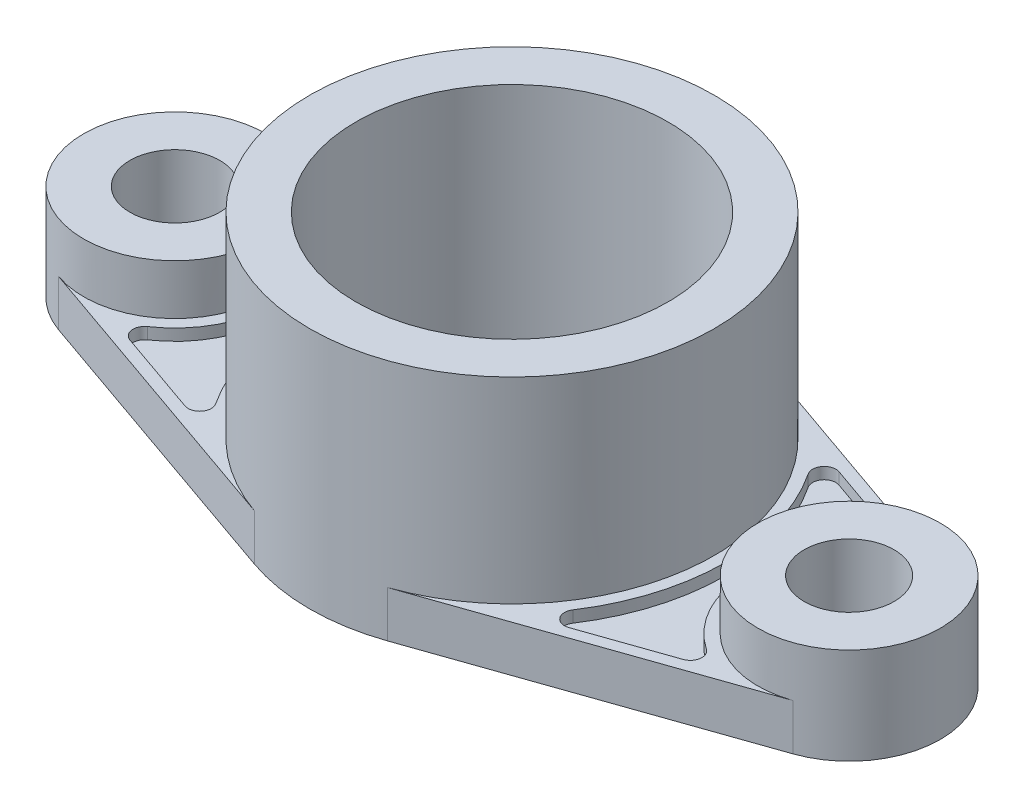
from build123d import *

# Parameters (mm, degrees)
SKETCH1_R           = 23.666666667
SKETCH1_R_2         = 11.666666667
BOSS_EXTRUDE1_DEPTH = 9
SKETCH1_5_R         = 23.666666667
SKETCH1_5_R_2       = 11.666666667
BOSS_EXTRUDE2_DEPTH = 25
BOSS_EXTRUDE3_DEPTH = 63
BOSS_EXTRUDE4_DEPTH = 3


with BuildPart() as part:
    # Sketch1 → Boss-Extrude1 (new body)
    # profile 1 of 8: a face of its own
    with BuildSketch(Plane(origin=(0, 0, 0), x_dir=(1, 0, 0), z_dir=(0, 1, 0))):
        with Locations((-87.5, 0)):
            Circle(SKETCH1_R)
        with Locations(Location((-87.5, 0, 0), (0, 0, 270))):
            Circle(SKETCH1_R_2, mode=Mode.SUBTRACT)
    # profile 2 of 8: a face of its own
    with BuildSketch(Plane(origin=(0, 0, 0), x_dir=(1, 0, 0), z_dir=(0, 1, 0))):
        with BuildLine():
            ThreePointArc((-17.3, -49.567731439), (-52.5, 0), (-17.3, 49.567731439))
            Line((-17.3, 49.567731439), (-95.298730159, 22.344818617))
            ThreePointArc((-95.298730159, 22.344818617), (-73.797059366, 19.296127308), (-63.833333333, 0))
            ThreePointArc((-63.833333333, 0), (-73.797059366, -19.296127308), (-95.298730159, -22.344818617))
            Line((-95.298730159, -22.344818617), (-17.3, -49.567731439))
        make_face()
    # profile 3 of 8: a face of its own
    with BuildSketch(Plane(origin=(0, 0, 0), x_dir=(1, 0, 0), z_dir=(0, 1, 0))):
        with BuildLine():
            ThreePointArc((52.5, 0), (42.804789452, 30.397368307), (17.3, 49.567731439))
            ThreePointArc((17.3, 49.567731439), (8.773371628, 51.761742149), (0, 52.5))
            Line((0, 52.5), (0, 40.5))
            ThreePointArc((0, 40.5), (28.637824638, 28.637824638), (40.5, 0))
            ThreePointArc((40.5, 0), (28.637824638, -28.637824638), (0, -40.5))
            Line((0, -40.5), (0, -52.5))
            ThreePointArc((0, -52.5), (8.773371628, -51.761742149), (17.3, -49.567731439))
            ThreePointArc((17.3, -49.567731439), (42.804789452, -30.397368307), (52.5, 0))
        make_face()
    # profile 4 of 8: a face of its own
    with BuildSketch(Plane(origin=(0, 0, 0), x_dir=(1, 0, 0), z_dir=(0, 1, 0))):
        with BuildLine():
            Line((0, 40.5), (0, 52.5))
            ThreePointArc((0, 52.5), (-8.773371628, 51.761742149), (-17.3, 49.567731439))
            ThreePointArc((-17.3, 49.567731439), (-52.5, 0), (-17.3, -49.567731439))
            ThreePointArc((-17.3, -49.567731439), (-8.773371628, -51.761742149), (0, -52.5))
            Line((0, -52.5), (0, -40.5))
            ThreePointArc((0, -40.5), (-40.5, 0), (0, 40.5))
        make_face()
    # profile 5 of 8: a face of its own
    with BuildSketch(Plane(origin=(0, 0, 0), x_dir=(1, 0, 0), z_dir=(0, 1, 0))):
        with BuildLine():
            ThreePointArc((52.5, 0), (42.804789452, 30.397368307), (17.3, 49.567731439))
            ThreePointArc((17.3, 49.567731439), (8.773371628, 51.761742149), (0, 52.5))
            Line((0, 52.5), (0, 40.5))
            ThreePointArc((0, 40.5), (28.637824638, 28.637824638), (40.5, 0))
            ThreePointArc((40.5, 0), (28.637824638, -28.637824638), (0, -40.5))
            Line((0, -40.5), (0, -52.5))
            ThreePointArc((0, -52.5), (8.773371628, -51.761742149), (17.3, -49.567731439))
            ThreePointArc((17.3, -49.567731439), (42.804789452, -30.397368307), (52.5, 0))
        make_face()
    # profile 6 of 8: a face of its own
    with BuildSketch(Plane(origin=(0, 0, 0), x_dir=(1, 0, 0), z_dir=(0, 1, 0))):
        with BuildLine():
            Line((0, 40.5), (0, 52.5))
            ThreePointArc((0, 52.5), (-8.773371628, 51.761742149), (-17.3, 49.567731439))
            ThreePointArc((-17.3, 49.567731439), (-52.5, 0), (-17.3, -49.567731439))
            ThreePointArc((-17.3, -49.567731439), (-8.773371628, -51.761742149), (0, -52.5))
            Line((0, -52.5), (0, -40.5))
            ThreePointArc((0, -40.5), (-40.5, 0), (0, 40.5))
        make_face()
    # profile 7 of 8: a face of its own
    with BuildSketch(Plane(origin=(0, 0, 0), x_dir=(1, 0, 0), z_dir=(0, 1, 0))):
        with BuildLine():
            Line((95.298730159, 22.344818617), (17.3, 49.567731439))
            ThreePointArc((17.3, 49.567731439), (42.804789452, 30.397368307), (52.5, 0))
            ThreePointArc((52.5, 0), (42.804789452, -30.397368307), (17.3, -49.567731439))
            Line((17.3, -49.567731439), (95.298730159, -22.344818617))
            ThreePointArc((95.298730159, -22.344818617), (63.833333333, 0), (95.298730159, 22.344818617))
        make_face()
    # profile 8 of 8: a face of its own
    with BuildSketch(Plane(origin=(0, 0, 0), x_dir=(1, 0, 0), z_dir=(0, 1, 0))):
        with Locations((87.5, 0)):
            Circle(SKETCH1_R)
        with Locations(Location((87.5, 0, 0), (0, 0, 270))):
            Circle(SKETCH1_R_2, mode=Mode.SUBTRACT)
    extrude(amount=BOSS_EXTRUDE1_DEPTH)

    # Sketch1<5> → Boss-Extrude2 (add)
    # profile 1 of 2: a face of its own
    with BuildSketch(Plane(origin=(0, 0, 0), x_dir=(1, 0, 0), z_dir=(0, 1, 0))):
        with Locations(Location((-87.5, 0, 0), (0, 0, 109.239875225))):
            Circle(SKETCH1_5_R)
        with Locations(Location((-87.5, 0, 0), (0, 0, 270))):
            Circle(SKETCH1_5_R_2, mode=Mode.SUBTRACT)
    # profile 2 of 2: a face of its own
    with BuildSketch(Plane(origin=(0, 0, 0), x_dir=(1, 0, 0), z_dir=(0, 1, 0))):
        with Locations(Location((87.5, 0, 0), (0, 0, 70.760124775))):
            Circle(SKETCH1_5_R)
        with Locations(Location((87.5, 0, 0), (0, 0, 270))):
            Circle(SKETCH1_5_R_2, mode=Mode.SUBTRACT)
    extrude(amount=BOSS_EXTRUDE2_DEPTH)

    # Sketch1<4> → Boss-Extrude3 (add)
    with BuildSketch(Plane(origin=(0, 0, 0), x_dir=(1, 0, 0), z_dir=(0, 1, 0))):
        with BuildLine():
            ThreePointArc((52.5, 0), (42.804789452, 30.397368307), (17.3, 49.567731439))
            ThreePointArc((17.3, 49.567731439), (8.773371628, 51.761742149), (0, 52.5))
            Line((0, 52.5), (0, 40.5))
            ThreePointArc((0, 40.5), (28.637824638, 28.637824638), (40.5, 0))
            ThreePointArc((40.5, 0), (28.637824638, -28.637824638), (0, -40.5))
            Line((0, -40.5), (0, -52.5))
            ThreePointArc((0, -52.5), (8.773371628, -51.761742149), (17.3, -49.567731439))
            ThreePointArc((17.3, -49.567731439), (42.804789452, -30.397368307), (52.5, 0))
        make_face()
        with BuildLine():
            Line((0, 40.5), (0, 52.5))
            ThreePointArc((0, 52.5), (-8.773371628, 51.761742149), (-17.3, 49.567731439))
            ThreePointArc((-17.3, 49.567731439), (-52.5, 0), (-17.3, -49.567731439))
            ThreePointArc((-17.3, -49.567731439), (-8.773371628, -51.761742149), (0, -52.5))
            Line((0, -52.5), (0, -40.5))
            ThreePointArc((0, -40.5), (-40.5, 0), (0, 40.5))
        make_face()
        with BuildLine():
            ThreePointArc((52.5, 0), (42.804789452, 30.397368307), (17.3, 49.567731439))
            ThreePointArc((17.3, 49.567731439), (8.773371628, 51.761742149), (0, 52.5))
            Line((0, 52.5), (0, 40.5))
            ThreePointArc((0, 40.5), (28.637824638, 28.637824638), (40.5, 0))
            ThreePointArc((40.5, 0), (28.637824638, -28.637824638), (0, -40.5))
            Line((0, -40.5), (0, -52.5))
            ThreePointArc((0, -52.5), (8.773371628, -51.761742149), (17.3, -49.567731439))
            ThreePointArc((17.3, -49.567731439), (42.804789452, -30.397368307), (52.5, 0))
        make_face()
        with BuildLine():
            Line((0, 40.5), (0, 52.5))
            ThreePointArc((0, 52.5), (-8.773371628, 51.761742149), (-17.3, 49.567731439))
            ThreePointArc((-17.3, 49.567731439), (-52.5, 0), (-17.3, -49.567731439))
            ThreePointArc((-17.3, -49.567731439), (-8.773371628, -51.761742149), (0, -52.5))
            Line((0, -52.5), (0, -40.5))
            ThreePointArc((0, -40.5), (-40.5, 0), (0, 40.5))
        make_face()
    extrude(amount=BOSS_EXTRUDE3_DEPTH)

    # Sketch3 → Boss-Extrude4 (add)
    # profile 1 of 2: a face of its own
    with BuildSketch(Plane(origin=(0, 9, 0), x_dir=(1, 0, 0), z_dir=(0, 1, 0))):
        with BuildLine():
            Line((17.3, -49.567731439), (95.298730159, -22.344818617))
            ThreePointArc((95.298730159, -22.344818617), (63.833333333, 0), (95.298730159, 22.344818617))
            Line((95.298730159, 22.344818617), (17.3, 49.567731439))
            ThreePointArc((17.3, 49.567731439), (52.5, 0), (17.3, -49.567731439))
        make_face()
        with BuildLine():
            Line((49.82533187, -35.038354757), (71.808532445, -27.365835582))
            ThreePointArc((71.808532445, -27.365835582), (73.794392677, -24.924234284), (72.506706531, -22.052488796))
            ThreePointArc((72.506706531, -22.052488796), (60.833333333, 0), (72.506706531, 22.052488796))
            ThreePointArc((72.506706531, 22.052488796), (73.794392677, 24.924234284), (71.808532445, 27.365835582))
            Line((71.808532445, 27.365835582), (49.82533187, 35.038354757))
            ThreePointArc((49.82533187, 35.038354757), (46.470096946, 34.049524606), (46.332311188, 30.55432768))
            ThreePointArc((46.332311188, 30.55432768), (55.5, 0), (46.332311188, -30.55432768))
            ThreePointArc((46.332311188, -30.55432768), (46.470096946, -34.049524606), (49.82533187, -35.038354757))
        make_face(mode=Mode.SUBTRACT)
    # profile 2 of 2: a face of its own
    with BuildSketch(Plane(origin=(0, 9, 0), x_dir=(1, 0, 0), z_dir=(0, 1, 0))):
        with BuildLine():
            Line((-17.3, 49.567731439), (-95.298730159, 22.344818617))
            ThreePointArc((-95.298730159, 22.344818617), (-63.833333333, 0), (-95.298730159, -22.344818617))
            Line((-95.298730159, -22.344818617), (-17.3, -49.567731439))
            ThreePointArc((-17.3, -49.567731439), (-52.5, 0), (-17.3, 49.567731439))
        make_face()
        with BuildLine():
            Line((-49.82533187, 35.038354757), (-71.808532445, 27.365835582))
            ThreePointArc((-71.808532445, 27.365835582), (-73.794392677, 24.924234284), (-72.506706531, 22.052488796))
            ThreePointArc((-72.506706531, 22.052488796), (-60.833333333, 0), (-72.506706531, -22.052488796))
            ThreePointArc((-72.506706531, -22.052488796), (-73.794392677, -24.924234284), (-71.808532445, -27.365835582))
            Line((-71.808532445, -27.365835582), (-49.82533187, -35.038354757))
            ThreePointArc((-49.82533187, -35.038354757), (-46.470096946, -34.049524606), (-46.332311188, -30.55432768))
            ThreePointArc((-46.332311188, -30.55432768), (-55.5, 0), (-46.332311188, 30.55432768))
            ThreePointArc((-46.332311188, 30.55432768), (-46.470096946, 34.049524606), (-49.82533187, 35.038354757))
        make_face(mode=Mode.SUBTRACT)
    extrude(amount=BOSS_EXTRUDE4_DEPTH)


solid = part.part
